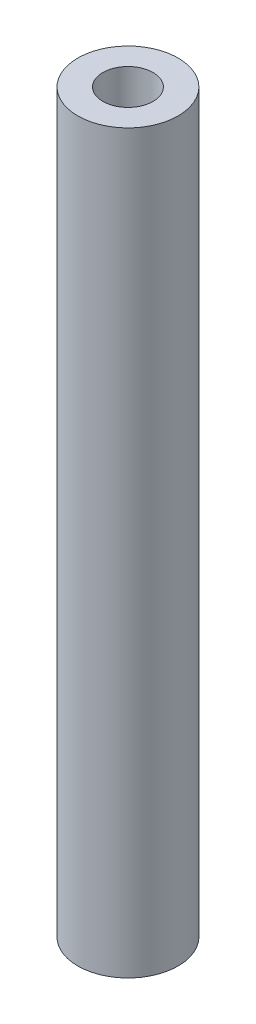
from build123d import *

# Parameters (mm, degrees)
SKETCH1_R           = 5.842
SKETCH1_R_2         = 2.921
BOSS_EXTRUDE1_DEPTH = 85.725


with BuildPart() as part:
    # Sketch1 → Boss-Extrude1 (new body)
    with BuildSketch(Plane(origin=(0, 0, 0), x_dir=(1, 0, 0), z_dir=(0, 1, 0))):
        with Locations(Location((0, 0, 0), (0, 0, 270))):
            Circle(SKETCH1_R)
        with Locations(Location((0, 0, 0), (0, 0, 270))):
            Circle(SKETCH1_R_2, mode=Mode.SUBTRACT)
    extrude(amount=BOSS_EXTRUDE1_DEPTH)


solid = part.part
